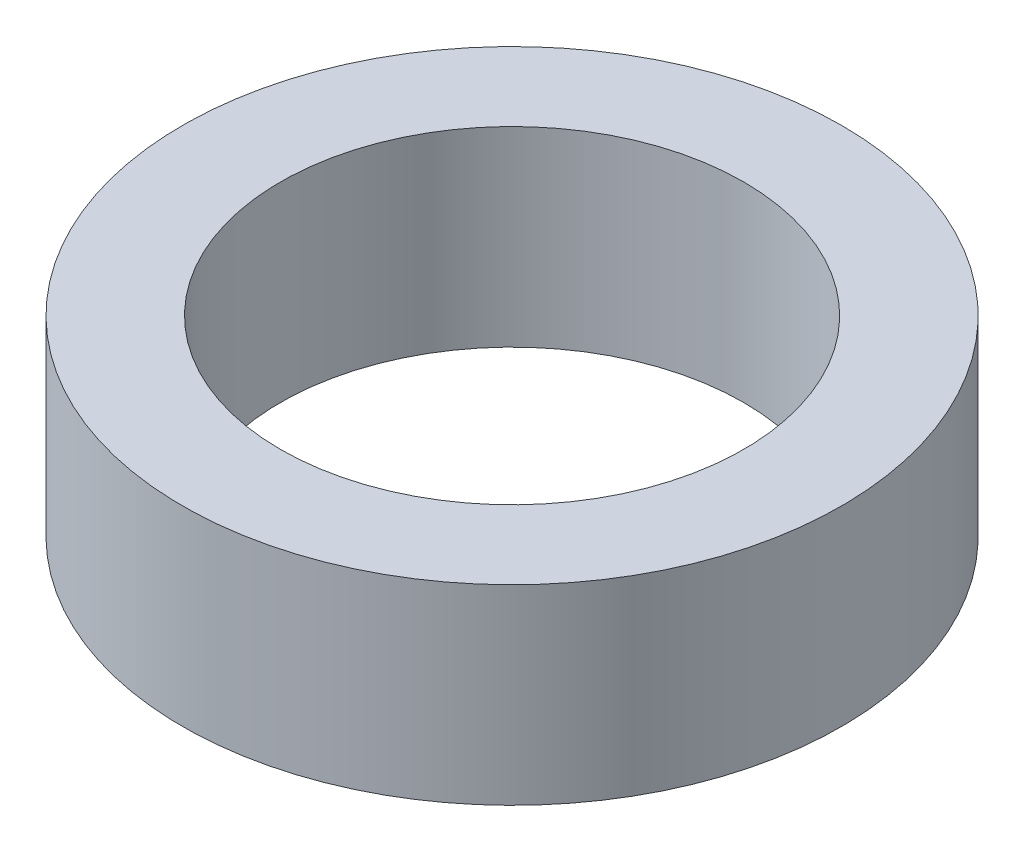
from build123d import *

# Parameters (mm, degrees)
SCHIZZO1_W = 20.5
SCHIZZO1_H = 40


with BuildPart() as part:
    # Schizzo1 → Rivoluzione1 (revolve)
    with BuildSketch(Plane.XY, mode=Mode.PRIVATE) as rivoluzione1_sk:
        with Locations((-58.75, 20)):
            Rectangle(SCHIZZO1_W, SCHIZZO1_H)
    revolve(rivoluzione1_sk.sketch.rotate(Axis((0, 0, 0), (0, 1, 0)), 270), axis=Axis((0, 0, 0), (0, 1, 0)))


solid = part.part
